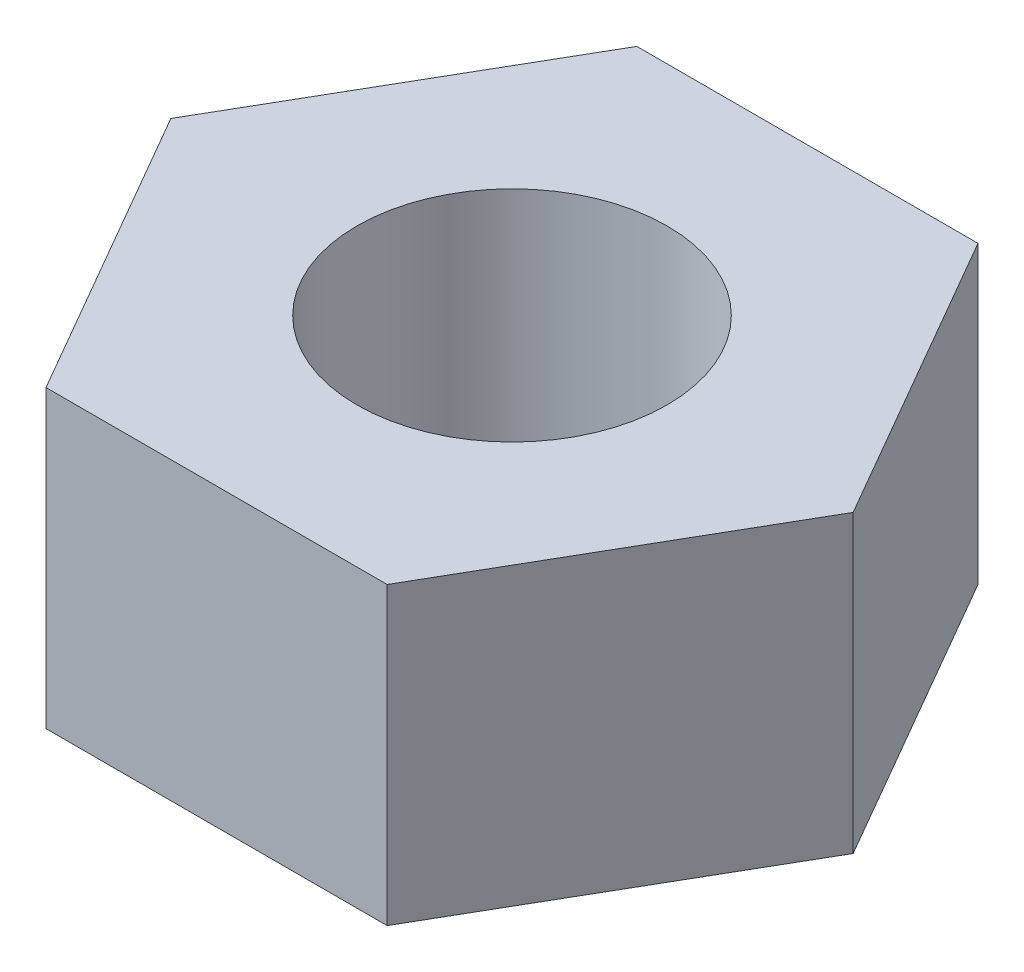
from build123d import *

# Parameters (mm, degrees)
CROQUIS1_R              = 2.1
SALIENTE_EXTRUIR1_DEPTH = 4


with BuildPart() as part:
    # Croquis1 → Saliente-Extruir1 (new body)
    with BuildSketch(Plane(origin=(0, 0, 0), x_dir=(1, 0, 0), z_dir=(0, 1, 0))):
        Polygon((-2.309401077, 4), (-4.618802154, 0), (-2.309401077, -4), (2.309401077, -4), (4.618802154, 0), (2.309401077, 4), align=None)
        with Locations(Location((0, 0, 0), (0, 0, 270))):
            Circle(CROQUIS1_R, mode=Mode.SUBTRACT)
    extrude(amount=SALIENTE_EXTRUIR1_DEPTH)


solid = part.part
